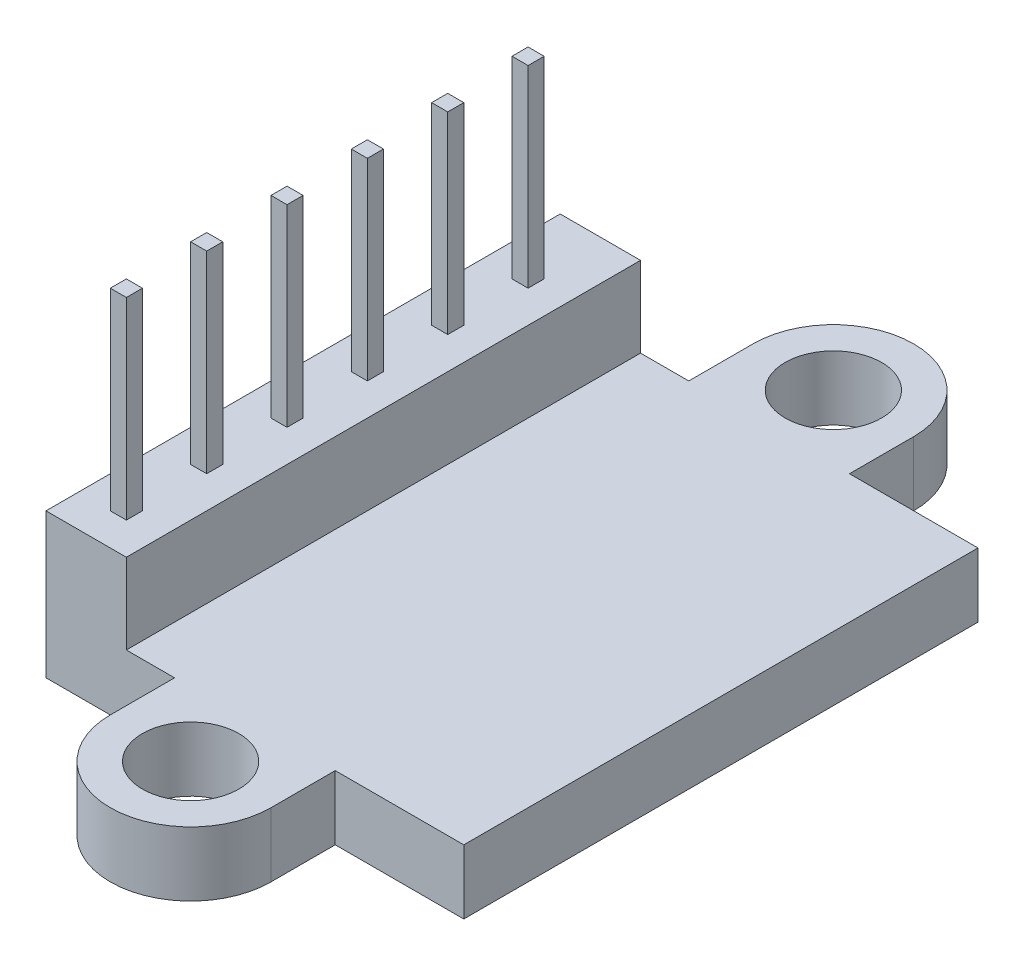
from build123d import *

# Parameters (mm, degrees)
SKETCH1_R           = 1.5
BOSS_EXTRUDE1_DEPTH = 2
SKETCH2_W           = 2.5
SKETCH2_H           = 2.5
SKETCH2_H_2         = 3
BOSS_EXTRUDE2_DEPTH = 2.5
SKETCH3_W           = 0.5
SKETCH3_H           = 0.5
BOSS_EXTRUDE3_DEPTH = 6
SKETCH4_W           = 2
SKETCH4_H           = 4
BOSS_EXTRUDE4_DEPTH = 1.5


with BuildPart() as part:
    # Sketch1 → Boss-Extrude1 (new body)
    with BuildSketch(Plane(origin=(0, 0, 0), x_dir=(1, 0, 0), z_dir=(0, 1, 0))):
        with BuildLine():
            Line((-6.5, -8), (-2.5, -8))
            Line((-2.5, -8), (-2.5, -10))
            ThreePointArc((-2.5, -10), (0, -12.5), (2.5, -10))
            Line((2.5, -10), (2.5, -8))
            Line((2.5, -8), (6.5, -8))
            Line((6.5, -8), (6.5, 8))
            Line((6.5, 8), (2.5, 8))
            Line((2.5, 8), (2.5, 10))
            ThreePointArc((2.5, 10), (0, 12.5), (-2.5, 10))
            Line((-2.5, 10), (-2.5, 8))
            Line((-2.5, 8), (-6.5, 8))
            Line((-6.5, 8), (-6.5, -8))
        make_face()
        with Locations(Location((0, 10, 0), (0, 0, 270))):
            Circle(SKETCH1_R, mode=Mode.SUBTRACT)
        with Locations(Location((0, -10, 0), (0, 0, 90))):
            Circle(SKETCH1_R, mode=Mode.SUBTRACT)
    extrude(amount=BOSS_EXTRUDE1_DEPTH)

    # Sketch2 → Boss-Extrude2 (add)
    with BuildSketch(Plane(origin=(0, 2, 0), x_dir=(1, 0, 0), z_dir=(0, 1, 0))):
        with Locations((-5.25, -6.75)):
            Rectangle(SKETCH2_W, SKETCH2_H)
        with Locations((-5.25, -4.25)):
            Rectangle(SKETCH2_W, SKETCH2_H)
        with Locations((-5.25, -1.5)):
            Rectangle(SKETCH2_W, SKETCH2_H_2)
        with Locations((-5.25, 1.5)):
            Rectangle(SKETCH2_W, SKETCH2_H_2)
        with Locations((-5.25, 4.25)):
            Rectangle(SKETCH2_W, SKETCH2_H)
        with Locations((-5.25, 6.75)):
            Rectangle(SKETCH2_W, SKETCH2_H)
    extrude(amount=BOSS_EXTRUDE2_DEPTH)

    # Sketch3 → Boss-Extrude3 (add)
    with BuildSketch(Plane(origin=(0, 4.5, 0), x_dir=(1, 0, 0), z_dir=(0, 1, 0))):
        with Locations((-5.25, -6.75)):
            Rectangle(SKETCH3_W, SKETCH3_H)
        with Locations((-5.25, -4.25)):
            Rectangle(SKETCH3_W, SKETCH3_H)
        with Locations((-5.25, -1.75)):
            Rectangle(SKETCH3_W, SKETCH3_H)
        with Locations((-5.25, 0.75)):
            Rectangle(SKETCH3_W, SKETCH3_H)
        with Locations((-5.25, 3.25)):
            Rectangle(SKETCH3_W, SKETCH3_H)
        with Locations((-5.25, 5.75)):
            Rectangle(SKETCH3_W, SKETCH3_H)
    extrude(amount=BOSS_EXTRUDE3_DEPTH)

    # Sketch4 → Boss-Extrude4 (add)
    with BuildSketch(Plane.XZ):
        with Locations((1.5, 0)):
            Rectangle(SKETCH4_W, SKETCH4_H)
    extrude(amount=BOSS_EXTRUDE4_DEPTH)


solid = part.part
